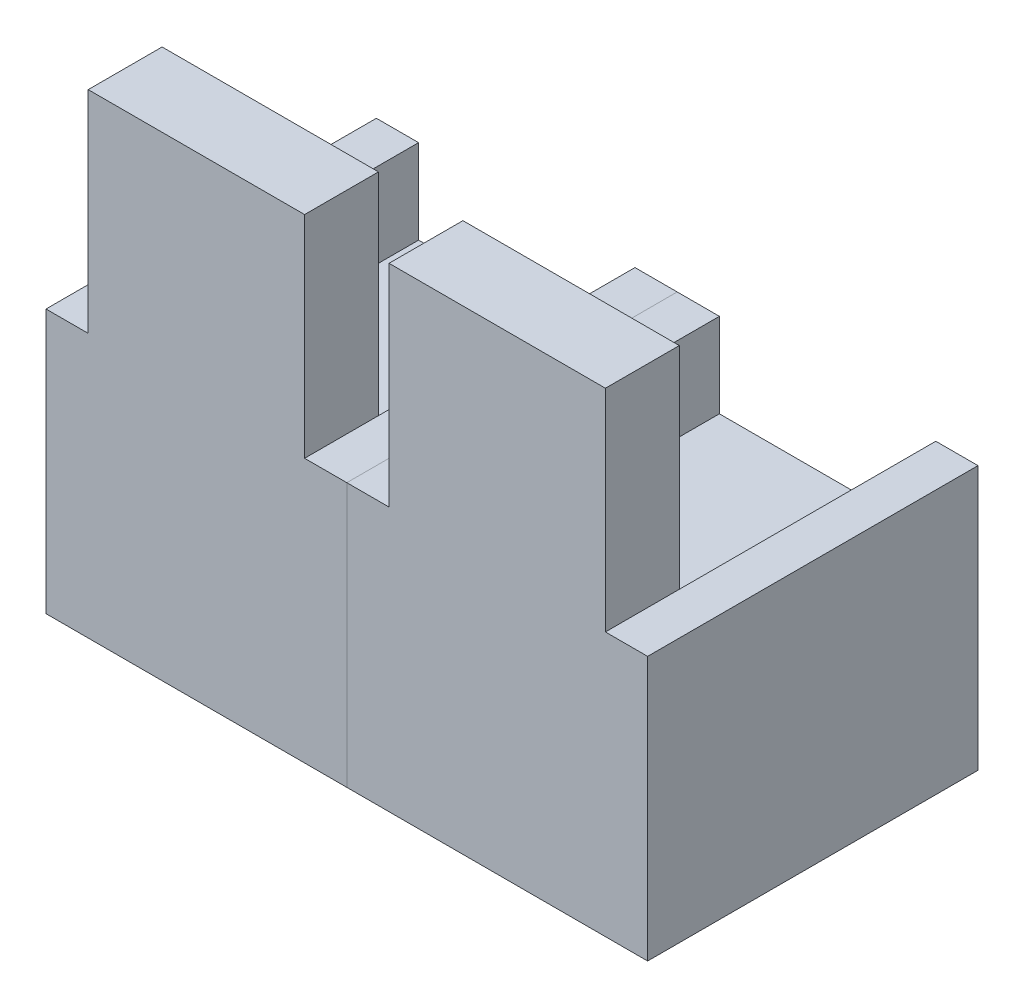
from build123d import *

# Parameters (mm, degrees)
SKETCH1_W           = 723.9
SKETCH1_H           = 795.02
BOSS_EXTRUDE1_DEPTH = 431.8
SKETCH2_W           = 101.6
SKETCH2_H           = 795.02
BOSS_EXTRUDE2_DEPTH = 203.2
SKETCH3_W           = 520.7
SKETCH3_H           = 177.8
BOSS_EXTRUDE3_DEPTH = 711.2
LPATTERN1_COUNT     = 2
LPATTERN1_PITCH     = 723.9


with BuildPart() as part:
    # Sketch1 → Boss-Extrude1 (new body)
    with BuildSketch(Plane(origin=(0, 0, 0), x_dir=(1, 0, 0), z_dir=(0, 1, 0))):
        with Locations((-33.853948498, -397.51)):
            Rectangle(SKETCH1_W, SKETCH1_H)
    extrude(amount=BOSS_EXTRUDE1_DEPTH)

    # Sketch2 → Boss-Extrude2 (add)
    with BuildSketch(Plane(origin=(0, 431.8, 0), x_dir=(1, 0, 0), z_dir=(0, 1, 0))):
        with Locations((-345.003948498, -397.51)):
            Rectangle(SKETCH2_W, SKETCH2_H)
        with Locations((277.296051502, -397.51)):
            Rectangle(SKETCH2_W, SKETCH2_H)
    extrude(amount=BOSS_EXTRUDE2_DEPTH)

    # Sketch3 → Boss-Extrude3 (add)
    with BuildSketch(Plane(origin=(0, 431.8, 0), x_dir=(1, 0, 0), z_dir=(0, 1, 0))):
        with Locations((-33.853948498, -706.12)):
            Rectangle(SKETCH3_W, SKETCH3_H)
    extrude(amount=BOSS_EXTRUDE3_DEPTH)


with BuildPart() as lpattern1_1:
    # LPattern1: pattern copy
    add(part.part.moved(Location(Vector(1, 0, 0) * (1 * LPATTERN1_PITCH))))


solid = Compound([part.part, lpattern1_1.part])
